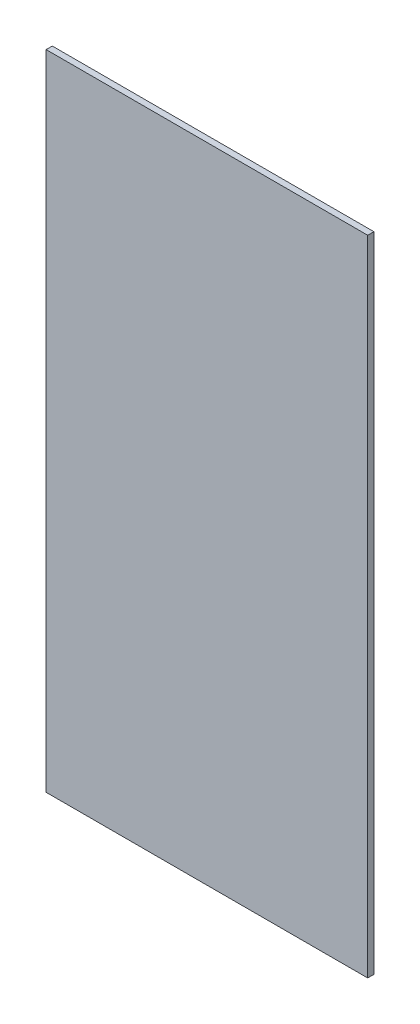
from build123d import *

# Parameters (mm, degrees)
SKETCH1_W           = 165.1
SKETCH1_H           = 330.2
BOSS_EXTRUDE1_DEPTH = 3.175


with BuildPart() as part:
    # Sketch1 → Boss-Extrude1 (new body)
    with BuildSketch(Plane.XY):
        Rectangle(SKETCH1_W, SKETCH1_H)
    extrude(amount=BOSS_EXTRUDE1_DEPTH)


solid = part.part
